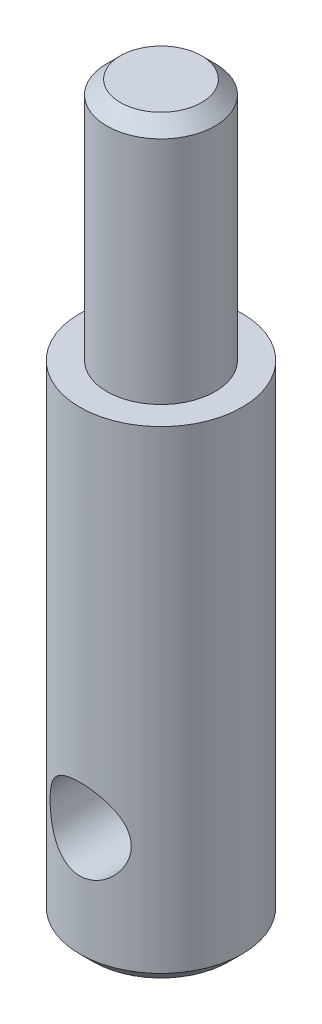
from build123d import *

# Parameters (mm, degrees)
SKETCH1_R           = 4
BOSS_EXTRUDE1_DEPTH = 18
SKETCH1_3_R         = 6
BOSS_EXTRUDE2_DEPTH = 36
SKETCH2_R           = 3
CUT_EXTRUDE1_DEPTH  = 18
CHAMFER1_SIZE       = 1
CHAMFER2_SIZE       = 1


with BuildPart() as part:
    # Sketch1 → Boss-Extrude1 (new body)
    with BuildSketch(Plane(origin=(0, 0, 0), x_dir=(1, 0, 0), z_dir=(0, 1, 0))):
        Circle(SKETCH1_R)
    extrude(amount=BOSS_EXTRUDE1_DEPTH)

    # Chamfer1
    chamfer1_edges = [part.edges().sort_by_distance(p)[0] for p in [
        (-4, 18, 0),
    ]]
    chamfer(chamfer1_edges, length=CHAMFER1_SIZE)


with BuildPart() as body_2:
    # Sketch1<3> → Boss-Extrude2 (new body)
    with BuildSketch(Plane(origin=(0, 0, 0), x_dir=(1, 0, 0), z_dir=(0, 1, 0))):
        Circle(SKETCH1_3_R)
    extrude(amount=-BOSS_EXTRUDE2_DEPTH)

    # Sketch2 → Cut-Extrude1 (cut, symmetric)
    with BuildSketch(Plane.XY):
        with Locations((0, -27)):
            Circle(SKETCH2_R)
    extrude(amount=CUT_EXTRUDE1_DEPTH, both=True, mode=Mode.SUBTRACT)

    # Chamfer2
    chamfer2_edges = [body_2.edges().sort_by_distance(p)[0] for p in [
        (-6, -36, 0),
    ]]
    chamfer(chamfer2_edges, length=CHAMFER2_SIZE)


solid = Compound([part.part, body_2.part])
